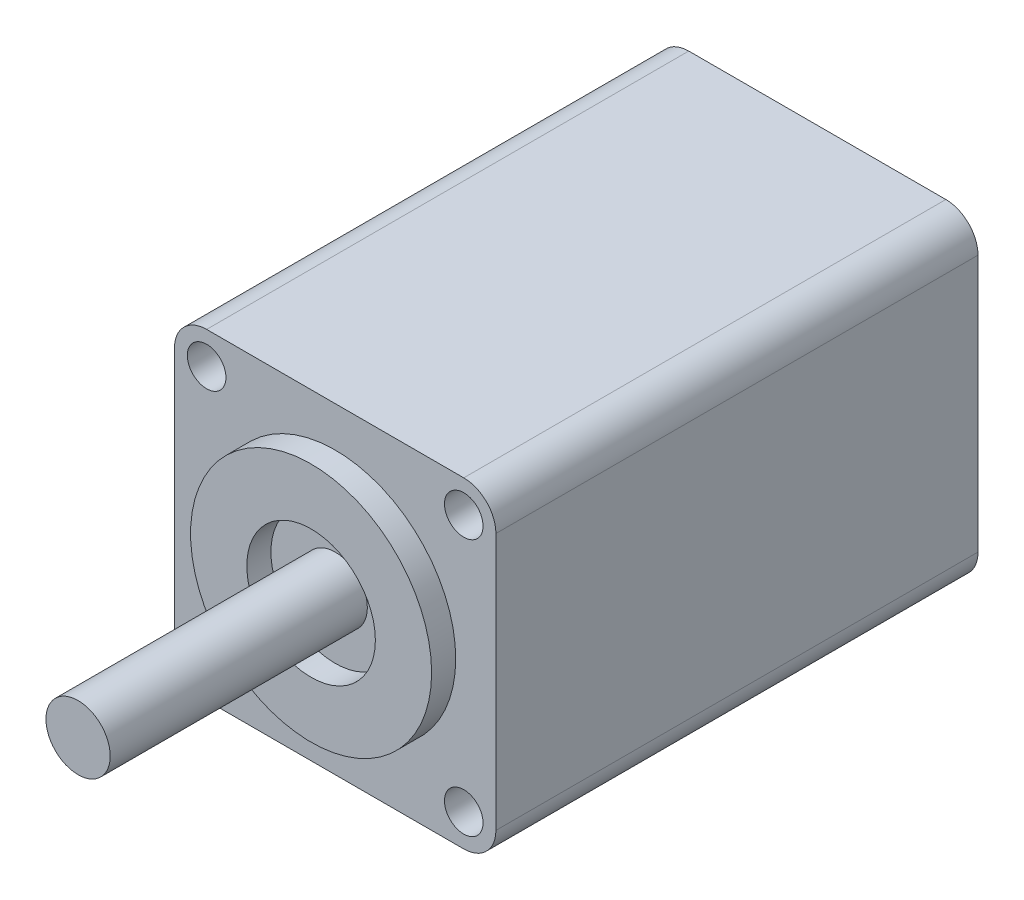
from build123d import *

# Parameters (mm, degrees)
BOSS_EXTRUDE1_DEPTH      = 30
SKETCH3_R                = 7.5
SKETCH3_R_2              = 4
BOSS_EXTRUDE2_DEPTH      = 1.5
SKETCH4_R                = 2
BOSS_EXTRUDE3_DEPTH      = 16
M2_CLEARANCE_HOLE1_D     = 2.4
M2_CLEARANCE_HOLE1_DEPTH = 3.5
M2_CLEARANCE_HOLE1_TIP   = 0.721032743


with BuildPart() as part:
    # Sketch1 → Boss-Extrude1 (new body)
    with BuildSketch(Plane.XY):
        with BuildLine():
            Line((-8, -10), (8, -10))
            ThreePointArc((8, -10), (9.414213562, -9.414213562), (10, -8))
            Line((10, -8), (10, 8))
            ThreePointArc((10, 8), (9.414213562, 9.414213562), (8, 10))
            Line((8, 10), (-8, 10))
            ThreePointArc((-8, 10), (-9.414213562, 9.414213562), (-10, 8))
            Line((-10, 8), (-10, -8))
            ThreePointArc((-10, -8), (-9.414213562, -9.414213562), (-8, -10))
        make_face()
    extrude(amount=-BOSS_EXTRUDE1_DEPTH)

    # Sketch3 → Boss-Extrude2 (add)
    with BuildSketch(Plane.XY):
        Circle(SKETCH3_R)
        Circle(SKETCH3_R_2, mode=Mode.SUBTRACT)
    extrude(amount=BOSS_EXTRUDE2_DEPTH)

    # Sketch4 → Boss-Extrude3 (add)
    with BuildSketch(Plane.XY):
        Circle(SKETCH4_R)
    extrude(amount=BOSS_EXTRUDE3_DEPTH)

    # M2 Clearance Hole1
    with Locations(Plane.XY):
        with Locations((-8, 8), (8, 8), (8, -8), (-8, -8)):
            Hole(M2_CLEARANCE_HOLE1_D / 2, depth=M2_CLEARANCE_HOLE1_DEPTH)
            with Locations((0, 0, -(M2_CLEARANCE_HOLE1_DEPTH + M2_CLEARANCE_HOLE1_TIP / 2))):  # 118° drill point
                Cone(0, M2_CLEARANCE_HOLE1_D / 2, M2_CLEARANCE_HOLE1_TIP, mode=Mode.SUBTRACT)


solid = part.part
